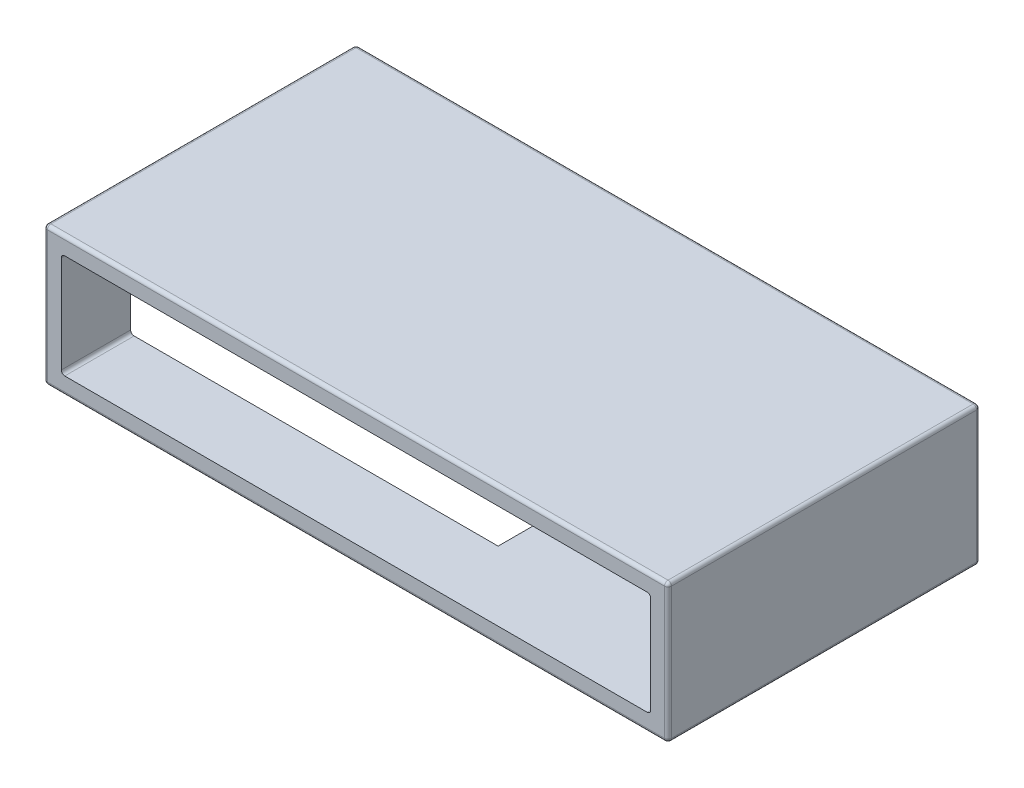
from build123d import *

# Parameters (mm, degrees)
SKETCH1_W           = 180
SKETCH1_H           = 40
SKETCH1_W_2         = 170
SKETCH1_H_2         = 30
BOSS_EXTRUDE1_DEPTH = 90
FILLET1_R           = 1
SKETCH2_W           = 110
SKETCH2_H           = 50
CUT_EXTRUDE1_DEPTH  = 25
SKETCH3_W           = 50
SKETCH3_H           = 30
CUT_EXTRUDE2_DEPTH  = 16
SKETCH4_R           = 2.5
CUT_EXTRUDE3_DEPTH  = 1


with BuildPart() as part:
    # Sketch1 → Boss-Extrude1 (new body)
    with BuildSketch(Plane.XY):
        Rectangle(SKETCH1_W, SKETCH1_H)
        Rectangle(SKETCH1_W_2, SKETCH1_H_2, mode=Mode.SUBTRACT)
    extrude(amount=BOSS_EXTRUDE1_DEPTH)

    # Fillet1
    fillet1_edges = [part.edges().sort_by_distance(p)[0] for p in [
        (-90, 0, 90),
        (85, -15, 45),
        (85, 15, 45),
        (-85, 15, 45),
        (-85, -15, 45),
        (0, -20, 90),
        (90, 0, 90),
        (0, -20, 0),
        (-90, 0, 0),
        (0, 20, 0),
        (90, 0, 0),
        (90, -20, 45),
        (-90, -20, 45),
        (-90, 20, 45),
        (90, 20, 45),
        (0, 20, 90),
    ]]
    fillet(fillet1_edges, radius=FILLET1_R)

    # Sketch2 → Cut-Extrude1 (cut)
    with BuildSketch(Plane.XZ.offset(20)):
        with Locations((-34, 45)):
            Rectangle(SKETCH2_W, SKETCH2_H)
    extrude(amount=-CUT_EXTRUDE1_DEPTH, mode=Mode.SUBTRACT)

    # Sketch3 → Cut-Extrude2 (cut)
    with BuildSketch(Plane.ZY.offset(90)):
        with Locations((45, -5)):
            Rectangle(SKETCH3_W, SKETCH3_H)
    extrude(amount=-CUT_EXTRUDE2_DEPTH, mode=Mode.SUBTRACT)

    # Sketch4 → Cut-Extrude3 (cut)
    with BuildSketch(Plane.ZY.offset(90)):
        with Locations((10, -6.59211648)):
            Circle(SKETCH4_R)
        with Locations(Location((80, -6.59211648, 0), (0, 0, 180))):
            Circle(SKETCH4_R)
    extrude(amount=-CUT_EXTRUDE3_DEPTH, mode=Mode.SUBTRACT)


solid = part.part
